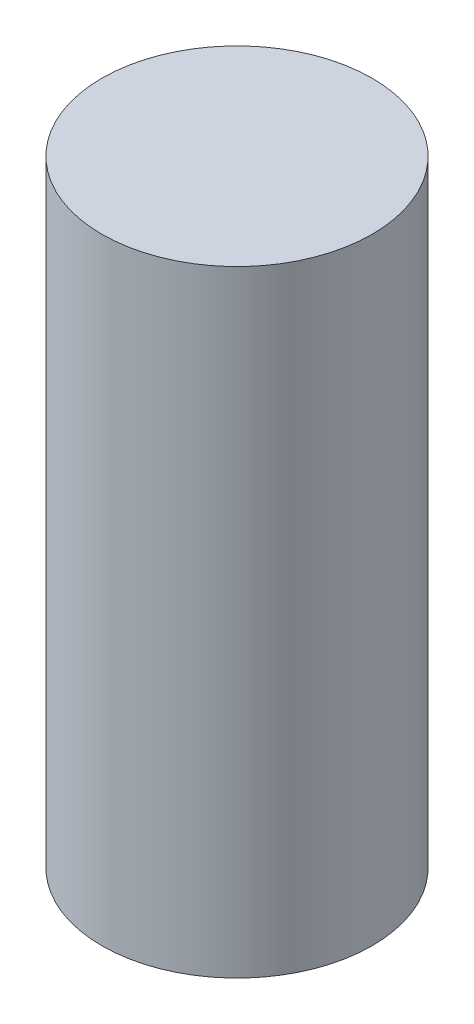
from build123d import *

# Parameters (mm, degrees)
SKETCH1_R           = 329
BOSS_EXTRUDE1_DEPTH = 1500


with BuildPart() as part:
    # Sketch1 → Boss-Extrude1 (new body)
    with BuildSketch(Plane(origin=(0, 0, 0), x_dir=(1, 0, 0), z_dir=(0, 1, 0))):
        with Locations(Location((0, 0, 0), (0, 0, 270))):
            Circle(SKETCH1_R)
    extrude(amount=BOSS_EXTRUDE1_DEPTH)


solid = part.part
